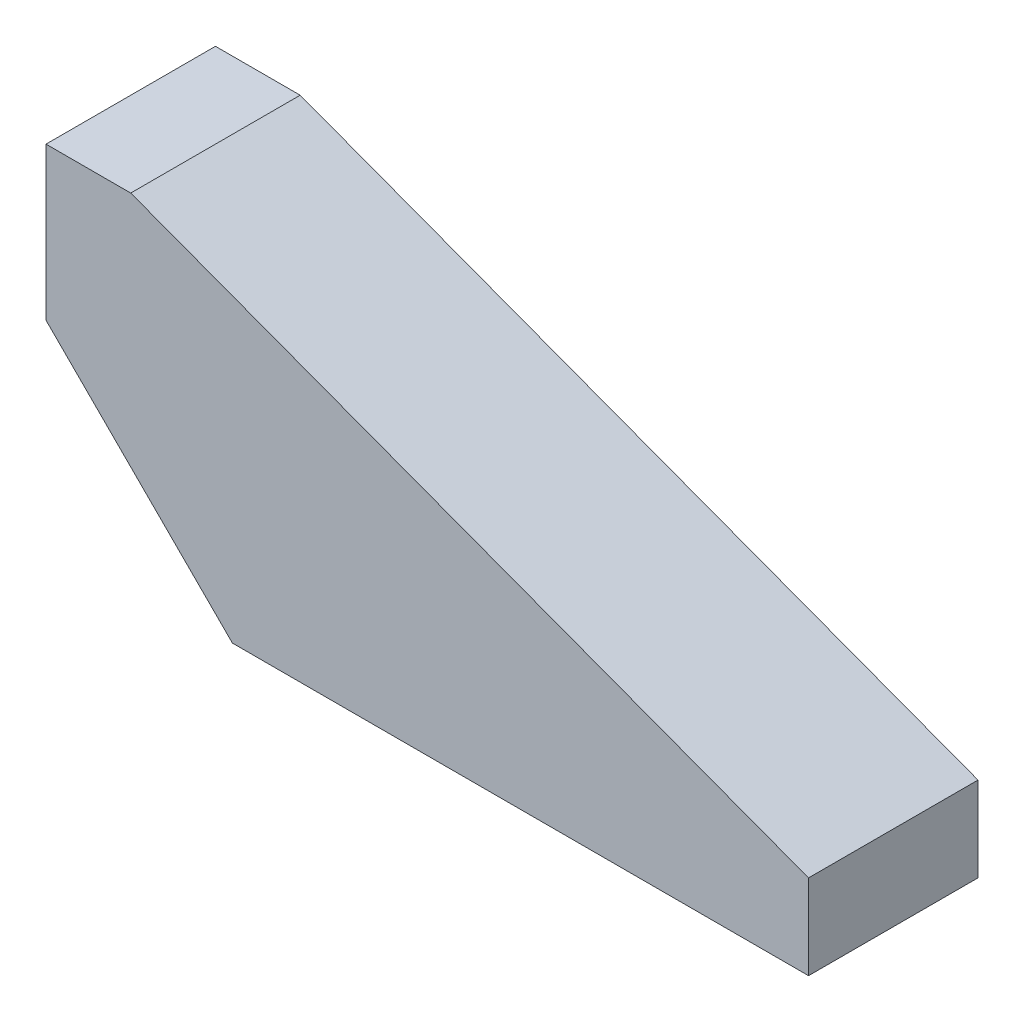
from build123d import *

# Parameters (mm, degrees)
EXTRUDE_1_DEPTH = 20


with BuildPart() as part:
    # 草图1 → 凸台-拉伸1 (new body)
    with BuildSketch(Plane.XY):
        Polygon((0, 0), (10, 0), (90, -30), (90, -40), (22, -40), (0, -18), align=None)
    extrude(amount=EXTRUDE_1_DEPTH)


solid = part.part
